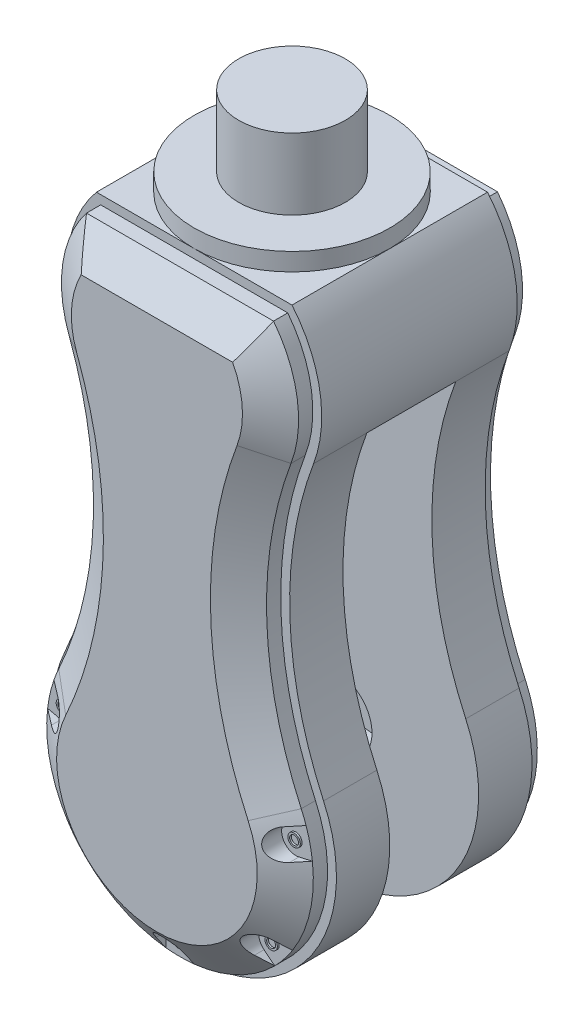
from build123d import *

# Parameters (mm, degrees)
SKETCH2_R                 = 27.5
BOSS_EXTRUDE1_DEPTH       = 5
BOSS_EXTRUDE2_DEPTH       = 15
BOSS_EXTRUDE3_DEPTH       = 4
BOSS_EXTRUDE4_DEPTH       = 6.5
BOSS_EXTRUDE4_TAPER       = 55
CUT_EXTRUDE1_DEPTH        = 6.5
SKETCH10_R                = 1.75
SKETCH10_R_2              = 1.25
BOSS_EXTRUDE5_DEPTH       = 0.5
CIRPATTERN1_COUNT         = 7
BOSS_EXTRUDE6_DEPTH       = 40
MIRROR2_COPY_1_DEPTH      = 6.5
MIRROR2_COPY_2_DEPTH      = 6.5
MIRROR2_COPY_3_DEPTH      = 6.5
MIRROR2_COPY_4_DEPTH      = 6.5
MIRROR2_COPY_5_SKETCH_R   = 1.75
MIRROR2_COPY_5_SKETCH_R_2 = 1.25
MIRROR2_COPY_5_DEPTH      = 0.5
MIRROR2_COPY_6_SKETCH_R   = 1.75
MIRROR2_COPY_6_SKETCH_R_2 = 1.25
MIRROR2_COPY_6_DEPTH      = 0.5
MIRROR2_COPY_7_SKETCH_R   = 1.75
MIRROR2_COPY_7_SKETCH_R_2 = 1.25
MIRROR2_COPY_7_DEPTH      = 0.5
MIRROR2_COPY_8_SKETCH_R   = 1.75
MIRROR2_COPY_8_SKETCH_R_2 = 1.25
MIRROR2_COPY_8_DEPTH      = 0.5
SKETCH12_R                = 15
BOSS_EXTRUDE7_DEPTH       = 20
SKETCH13_R                = 10
CUT_EXTRUDE2_DEPTH        = 10


with BuildPart() as part:
    # Sketch2 → Boss-Extrude1 (new body)
    with BuildSketch(Plane(origin=(0, 0, 0), x_dir=(1, 0, 0), z_dir=(0, 1, 0))):
        with Locations(Location((0, 0, 0), (0, 0, 270))):
            Circle(SKETCH2_R)
    extrude(amount=BOSS_EXTRUDE1_DEPTH)

    # Sketch4 → Boss-Extrude2 (add)
    with BuildSketch(Plane(origin=(0, 0, 27.5), x_dir=(-1, 0, 0), z_dir=(0, 0, -1))):
        with BuildLine():
            Line((-27.5, 0), (27.5, 0))
            ThreePointArc((27.5, 0), (35.342397693, -16.986271931), (33.559326422, -35.610377079))
            ThreePointArc((33.559326422, -35.610377079), (26.90246469, -76.264932598), (36.373406497, -116.357425085))
            ThreePointArc((36.373406497, -116.357425085), (0, -173), (-36.373406497, -116.357425085))
            ThreePointArc((-36.373406497, -116.357425085), (-26.90246469, -76.264932598), (-33.559326422, -35.610377079))
            ThreePointArc((-33.559326422, -35.610377079), (-35.342397693, -16.986271931), (-27.5, 0))
        make_face()
    boss_extrude2 = extrude(amount=BOSS_EXTRUDE2_DEPTH)

    # Sketch5 → Boss-Extrude3 (add)
    with BuildSketch(Plane.XY.offset(27.5)):
        with BuildLine():
            Line((26.305856426, -2.5), (0, -2.5))
            Line((0, -2.5), (-26.305856426, -2.5))
            ThreePointArc((-26.305856426, -2.5), (-32.969520466, -17.974186382), (-31.219091597, -34.731001754))
            ThreePointArc((-31.219091597, -34.731001754), (-24.40398151, -76.352006143), (-34.100068591, -117.397586017))
            ThreePointArc((-34.100068591, -117.397586017), (0, -170.5), (34.100068591, -117.397586017))
            ThreePointArc((34.100068591, -117.397586017), (24.40398151, -76.352006143), (31.219091597, -34.731001754))
            ThreePointArc((31.219091597, -34.731001754), (32.969520466, -17.974186382), (26.305856426, -2.5))
        make_face()
    boss_extrude3 = extrude(amount=BOSS_EXTRUDE3_DEPTH)

    # Sketch7 → Boss-Extrude4 (add)
    with BuildSketch(Plane.XY.offset(31.5)):
        with BuildLine():
            Line((26.305856426, -2.5), (-26.305856426, -2.5))
            ThreePointArc((-26.305856426, -2.5), (-32.969520466, -17.974186382), (-31.219091597, -34.731001754))
            ThreePointArc((-31.219091597, -34.731001754), (-24.40398151, -76.352006143), (-34.100068591, -117.397586017))
            ThreePointArc((-34.100068591, -117.397586017), (0, -170.5), (34.100068591, -117.397586017))
            ThreePointArc((34.100068591, -117.397586017), (24.40398151, -76.352006143), (31.219091597, -34.731001754))
            ThreePointArc((31.219091597, -34.731001754), (32.969520466, -17.974186382), (26.305856426, -2.5))
        make_face()
    boss_extrude4 = extrude(amount=BOSS_EXTRUDE4_DEPTH, taper=BOSS_EXTRUDE4_TAPER)

    # Sketch9 → Cut-Extrude1 (cut)
    with BuildSketch(Plane.XY.offset(38)):
        with BuildLine():
            Line((0, -173.917915562), (0, -170.418546903))
            Line((0, -170.418546903), (0, -166.418546903))
            Line((0, -166.418546903), (0, -162.418546903))
            ThreePointArc((0, -162.418546903), (-2.828427125, -163.590119778), (-4, -166.418546903))
            Line((-4, -166.418546903), (-4, -173.917915562))
            Line((-4, -173.917915562), (0, -173.917915562))
        make_face()
        with BuildLine():
            Line((0, -166.418546903), (0, -170.418546903))
            Line((0, -170.418546903), (0, -173.917915562))
            Line((0, -173.917915562), (4, -173.917915562))
            Line((4, -173.917915562), (4, -166.418546903))
            ThreePointArc((4, -166.418546903), (2.828427125, -163.590119778), (0, -162.418546903))
            Line((0, -162.418546903), (0, -166.418546903))
        make_face()
    cut_extrude1 = extrude(amount=-CUT_EXTRUDE1_DEPTH, mode=Mode.SUBTRACT)

    # Sketch10 → Boss-Extrude5 (add)
    with BuildSketch(Plane.XY.offset(31.5)):
        with Locations((0, -166.418546903)):
            Circle(SKETCH10_R)
        with Locations((0, -166.418546903)):
            Circle(SKETCH10_R_2, mode=Mode.SUBTRACT)
    boss_extrude5 = extrude(amount=BOSS_EXTRUDE5_DEPTH)

    # CirPattern1: Cut-Extrude1, Boss-Extrude5 ×7 about axis, 2 skipped
    cirpattern1_axis = Axis((0, -133, 0), (0, 0, 1))
    add([cut_extrude1.rotate(cirpattern1_axis, i * 360 / CIRPATTERN1_COUNT) for i in range(1, CIRPATTERN1_COUNT) if i not in (3, 4)], mode=Mode.SUBTRACT)
    add([boss_extrude5.rotate(cirpattern1_axis, i * 360 / CIRPATTERN1_COUNT) for i in range(1, CIRPATTERN1_COUNT) if i not in (3, 4)])

    # Sketch11 → Boss-Extrude6 (add)
    with BuildSketch(Plane(origin=(0, 0, 12.5), x_dir=(-1, 0, 0), z_dir=(0, 0, -1))):
        with BuildLine():
            Line((-33.559326422, -35.610377079), (33.559326422, -35.610377079))
            ThreePointArc((33.559326422, -35.610377079), (35.342397693, -16.986271931), (27.5, 0))
            Line((27.5, 0), (24.494897428, 0))
            Line((24.494897428, 0), (-24.494897428, 0))
            Line((-24.494897428, 0), (-27.5, 0))
            ThreePointArc((-27.5, 0), (-35.342397693, -16.986271931), (-33.559326422, -35.610377079))
        make_face()
    extrude(amount=BOSS_EXTRUDE6_DEPTH)

    # Mirror2: Boss-Extrude2, Boss-Extrude3, Boss-Extrude4, Cut-Extrude1, Boss-Extrude5 across plane
    add(boss_extrude2.mirror(Plane.XY))
    add(boss_extrude3.mirror(Plane.XY))
    add(boss_extrude4.mirror(Plane.XY))
    add(cut_extrude1.mirror(Plane.XY), mode=Mode.SUBTRACT)
    add(boss_extrude5.mirror(Plane.XY))

    # Mirror2 copy 1 sketch → Mirror2 copy 1 (cut)
    with BuildSketch(Plane(origin=(-103.983587168, -50.075856353, -38), x_dir=(0.6234898018587336, 0.7818314824680298, 0), z_dir=(0, 0, -1))):
        with BuildLine():
            Line((0, 173.917915562), (0, 170.418546903))
            Line((0, 170.418546903), (0, 166.418546903))
            Line((0, 166.418546903), (0, 162.418546903))
            ThreePointArc((0, 162.418546903), (-2.828427125, 163.590119778), (-4, 166.418546903))
            Line((-4, 166.418546903), (-4, 173.917915562))
            Line((-4, 173.917915562), (0, 173.917915562))
        make_face()
        with BuildLine():
            Line((0, 166.418546903), (0, 170.418546903))
            Line((0, 170.418546903), (0, 173.917915562))
            Line((0, 173.917915562), (4, 173.917915562))
            Line((4, 173.917915562), (4, 166.418546903))
            ThreePointArc((4, 166.418546903), (2.828427125, 163.590119778), (0, 162.418546903))
            Line((0, 162.418546903), (0, 166.418546903))
        make_face()
    extrude(amount=-MIRROR2_COPY_1_DEPTH, mode=Mode.SUBTRACT)

    # Mirror2 copy 2 sketch → Mirror2 copy 2 (cut)
    with BuildSketch(Plane(origin=(-129.66541232, -162.595284216, -38), x_dir=(-0.22252093395631434, 0.9749279121818236, 0), z_dir=(0, 0, -1))):
        with BuildLine():
            Line((0, 173.917915562), (0, 170.418546903))
            Line((0, 170.418546903), (0, 166.418546903))
            Line((0, 166.418546903), (0, 162.418546903))
            ThreePointArc((0, 162.418546903), (-2.828427125, 163.590119778), (-4, 166.418546903))
            Line((-4, 166.418546903), (-4, 173.917915562))
            Line((-4, 173.917915562), (0, 173.917915562))
        make_face()
        with BuildLine():
            Line((0, 166.418546903), (0, 170.418546903))
            Line((0, 170.418546903), (0, 173.917915562))
            Line((0, 173.917915562), (4, 173.917915562))
            Line((4, 173.917915562), (4, 166.418546903))
            ThreePointArc((4, 166.418546903), (2.828427125, 163.590119778), (0, 162.418546903))
            Line((0, 162.418546903), (0, 166.418546903))
        make_face()
    extrude(amount=-MIRROR2_COPY_2_DEPTH, mode=Mode.SUBTRACT)

    # Mirror2 copy 3 sketch → Mirror2 copy 3 (cut)
    with BuildSketch(Plane(origin=(129.66541232, -162.595284216, -38), x_dir=(-0.2225209339563137, -0.9749279121818237, 0), z_dir=(0, 0, -1))):
        with BuildLine():
            Line((0, 173.917915562), (0, 170.418546903))
            Line((0, 170.418546903), (0, 166.418546903))
            Line((0, 166.418546903), (0, 162.418546903))
            ThreePointArc((0, 162.418546903), (-2.828427125, 163.590119778), (-4, 166.418546903))
            Line((-4, 166.418546903), (-4, 173.917915562))
            Line((-4, 173.917915562), (0, 173.917915562))
        make_face()
        with BuildLine():
            Line((0, 166.418546903), (0, 170.418546903))
            Line((0, 170.418546903), (0, 173.917915562))
            Line((0, 173.917915562), (4, 173.917915562))
            Line((4, 173.917915562), (4, 166.418546903))
            ThreePointArc((4, 166.418546903), (2.828427125, 163.590119778), (0, 162.418546903))
            Line((0, 162.418546903), (0, 166.418546903))
        make_face()
    extrude(amount=-MIRROR2_COPY_3_DEPTH, mode=Mode.SUBTRACT)

    # Mirror2 copy 4 sketch → Mirror2 copy 4 (cut)
    with BuildSketch(Plane(origin=(103.983587168, -50.075856353, -38), x_dir=(0.6234898018587334, -0.7818314824680299, 0), z_dir=(0, 0, -1))):
        with BuildLine():
            Line((0, 173.917915562), (0, 170.418546903))
            Line((0, 170.418546903), (0, 166.418546903))
            Line((0, 166.418546903), (0, 162.418546903))
            ThreePointArc((0, 162.418546903), (-2.828427125, 163.590119778), (-4, 166.418546903))
            Line((-4, 166.418546903), (-4, 173.917915562))
            Line((-4, 173.917915562), (0, 173.917915562))
        make_face()
        with BuildLine():
            Line((0, 166.418546903), (0, 170.418546903))
            Line((0, 170.418546903), (0, 173.917915562))
            Line((0, 173.917915562), (4, 173.917915562))
            Line((4, 173.917915562), (4, 166.418546903))
            ThreePointArc((4, 166.418546903), (2.828427125, 163.590119778), (0, 162.418546903))
            Line((0, 162.418546903), (0, 166.418546903))
        make_face()
    extrude(amount=-MIRROR2_COPY_4_DEPTH, mode=Mode.SUBTRACT)

    # Mirror2 copy 5 sketch → Mirror2 copy 5 (add)
    with BuildSketch(Plane(origin=(-103.983587168, -50.075856353, -31.5), x_dir=(0.6234898018587336, 0.7818314824680298, 0), z_dir=(0, 0, -1))):
        with Locations((0, 166.418546903)):
            Circle(MIRROR2_COPY_5_SKETCH_R)
        with Locations((0, 166.418546903)):
            Circle(MIRROR2_COPY_5_SKETCH_R_2, mode=Mode.SUBTRACT)
    extrude(amount=MIRROR2_COPY_5_DEPTH)

    # Mirror2 copy 6 sketch → Mirror2 copy 6 (add)
    with BuildSketch(Plane(origin=(-129.66541232, -162.595284216, -31.5), x_dir=(-0.22252093395631434, 0.9749279121818236, 0), z_dir=(0, 0, -1))):
        with Locations((0, 166.418546903)):
            Circle(MIRROR2_COPY_6_SKETCH_R)
        with Locations((0, 166.418546903)):
            Circle(MIRROR2_COPY_6_SKETCH_R_2, mode=Mode.SUBTRACT)
    extrude(amount=MIRROR2_COPY_6_DEPTH)

    # Mirror2 copy 7 sketch → Mirror2 copy 7 (add)
    with BuildSketch(Plane(origin=(129.66541232, -162.595284216, -31.5), x_dir=(-0.2225209339563137, -0.9749279121818237, 0), z_dir=(0, 0, -1))):
        with Locations((0, 166.418546903)):
            Circle(MIRROR2_COPY_7_SKETCH_R)
        with Locations((0, 166.418546903)):
            Circle(MIRROR2_COPY_7_SKETCH_R_2, mode=Mode.SUBTRACT)
    extrude(amount=MIRROR2_COPY_7_DEPTH)

    # Mirror2 copy 8 sketch → Mirror2 copy 8 (add)
    with BuildSketch(Plane(origin=(103.983587168, -50.075856353, -31.5), x_dir=(0.6234898018587334, -0.7818314824680299, 0), z_dir=(0, 0, -1))):
        with Locations((0, 166.418546903)):
            Circle(MIRROR2_COPY_8_SKETCH_R)
        with Locations((0, 166.418546903)):
            Circle(MIRROR2_COPY_8_SKETCH_R_2, mode=Mode.SUBTRACT)
    extrude(amount=MIRROR2_COPY_8_DEPTH)

    # Sketch12 → Boss-Extrude7 (add)
    with BuildSketch(Plane(origin=(0, 5, 0), x_dir=(1, 0, 0), z_dir=(0, 1, 0))):
        with Locations(Location((0, 0, 0), (0, 0, 270))):
            Circle(SKETCH12_R)
    extrude(amount=BOSS_EXTRUDE7_DEPTH)

    # Sketch13 → Cut-Extrude2 (cut)
    with BuildSketch(Plane.XY.offset(-12.5)):
        with Locations((0, -133)):
            Circle(SKETCH13_R)
    cut_extrude2 = extrude(amount=-CUT_EXTRUDE2_DEPTH, mode=Mode.SUBTRACT)

    # Mirror3: Cut-Extrude2 across plane
    add(cut_extrude2.mirror(Plane.XY), mode=Mode.SUBTRACT)


solid = part.part
